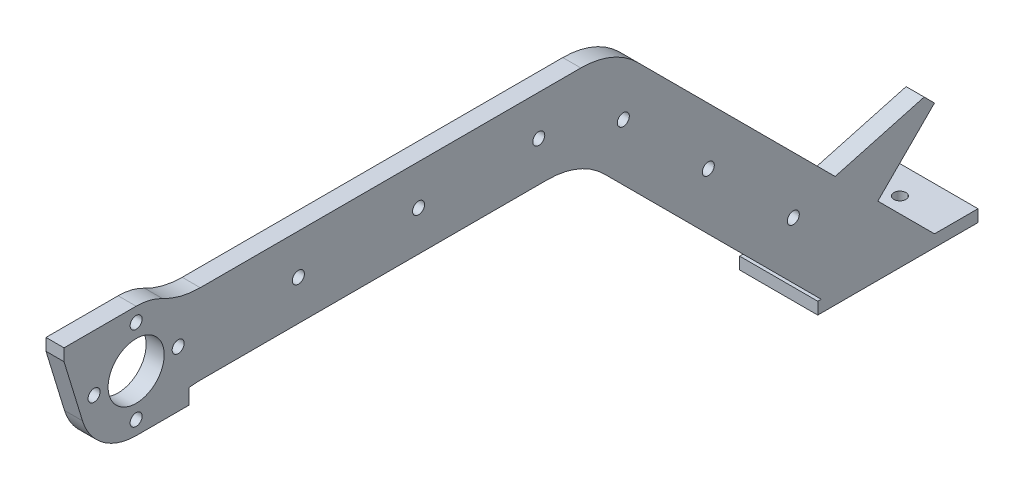
from build123d import *

# Parameters (mm, degrees)
SKETCH_1_R          = 1.5
SKETCH_1_R_2        = 7
EXTRUDE_1_DEPTH     = 2.25
SKETCH_3_W          = 19.5
SKETCH_3_H          = 40
EXTRUDE_2_DEPTH     = 3
SKETCH_4_R          = 1.5
CUT_EXTRUDE_1_DEPTH = 227.967348396
SKETCH_5_W          = 4.5
SKETCH_5_H          = 15.072529032
EXTRUDE_3_DEPTH     = 20
CUT_EXTRUDE_3_DEPTH = 10


with BuildPart() as part:
    # 草图1 → 凸台-拉伸1 (new, symmetric)
    with BuildSketch(Plane(origin=(0, 0, 0), x_dir=(0, 0, -1), z_dir=(1, 0, 0))):
        with BuildLine():
            ThreePointArc((102.736907967, -10), (110.379173808, -11.526455333), (116.85785315, -15.85785315))
            Line((116.85785315, -15.85785315), (171, -70))
            Line((171, -70), (199.284271247, -70))
            Line((199.284271247, -70), (125.142135624, 4.142135624))
            ThreePointArc((125.142135624, 4.142135624), (118.653668647, 8.47759065), (111, 10))
            Line((111, 10), (16, 10))
            ThreePointArc((16, 10), (11.149287499, 10.597149997), (6.588235294, 12.352941176))
            ThreePointArc((6.588235294, 12.352941176), (3.395498751, 13.581995002), (0, 14))
            Line((0, 14), (-18, 14))
            Line((-18, 14), (-18, 11))
            Line((-18, 11), (-13.388941598, -4.090995342))
            ThreePointArc((-13.388941598, -4.090995342), (-8.328447191, -11.253309175), (0, -14))
            Line((0, -14), (13.224243357, -14))
            Line((13.224243357, -14), (13.224243357, -10.193557234))
            ThreePointArc((13.224243357, -10.193557234), (14.608751519, -10.048447989), (16, -10))
            Line((16, -10), (102.736907967, -10))
        make_face()
        with Locations((164.036406871, -48.894271247)):
            Circle(SKETCH_1_R, mode=Mode.SUBTRACT)
        with Locations((142.823203436, -27.681067812)):
            Circle(SKETCH_1_R, mode=Mode.SUBTRACT)
        with Locations((0, -10.5)):
            Circle(SKETCH_1_R, mode=Mode.SUBTRACT)
        with Locations((-10.5, 0)):
            Circle(SKETCH_1_R, mode=Mode.SUBTRACT)
        Circle(SKETCH_1_R_2, mode=Mode.SUBTRACT)
        with Locations((10.5, 0)):
            Circle(SKETCH_1_R, mode=Mode.SUBTRACT)
        with Locations((0, 10.5)):
            Circle(SKETCH_1_R, mode=Mode.SUBTRACT)
        with Locations((40.5, 0)):
            Circle(SKETCH_1_R, mode=Mode.SUBTRACT)
        with Locations((70.5, 0)):
            Circle(SKETCH_1_R, mode=Mode.SUBTRACT)
        with Locations((121.61, -6.467864376)):
            Circle(SKETCH_1_R, mode=Mode.SUBTRACT)
        with Locations((100.5, 0)):
            Circle(SKETCH_1_R, mode=Mode.SUBTRACT)
    extrude(amount=EXTRUDE_1_DEPTH, both=True)

    # 草图3 → 凸台-拉伸2 (add)
    with BuildSketch(Plane.XZ.offset(70)):
        with Locations((-7.5, -190.144271247)):
            Rectangle(SKETCH_3_W, SKETCH_3_H)
    extrude(amount=EXTRUDE_2_DEPTH)

    # 草图4 → 切除-拉伸1 (cut, through all)
    with BuildSketch(Plane(origin=(0, -70, 0), x_dir=(1, 0, 0), z_dir=(0, 1, 0))):
        with Locations(Location((-10.25, 203.144271247, 0), (0, 0, 270))):
            Circle(SKETCH_4_R)
        with Locations(Location((-10.25, 177.144271247, 0), (0, 0, 90))):
            Circle(SKETCH_4_R)
    extrude(amount=-CUT_EXTRUDE_1_DEPTH, mode=Mode.SUBTRACT)

    # 草图5 → 凸台-拉伸3 (add)
    with BuildSketch(Plane(origin=(0, 64.642135624, -64.642135624), x_dir=(1, 0, 0), z_dir=(0, 0.7071067811865465, -0.7071067811865487))):
        with Locations((0, 162.87646975)):
            Rectangle(SKETCH_5_W, SKETCH_5_H)
    extrude(amount=EXTRUDE_3_DEPTH)

    # 草图9 → 切除-拉伸3 (cut)
    with BuildSketch(Plane.ZY.offset(2.25)):
        Polygon((-196.699542099, -39.130999604), (-174.484248136, -45.199976888), (-188.626383759, -31.057841264), align=None)
    extrude(amount=-CUT_EXTRUDE_3_DEPTH, mode=Mode.SUBTRACT)


solid = part.part
